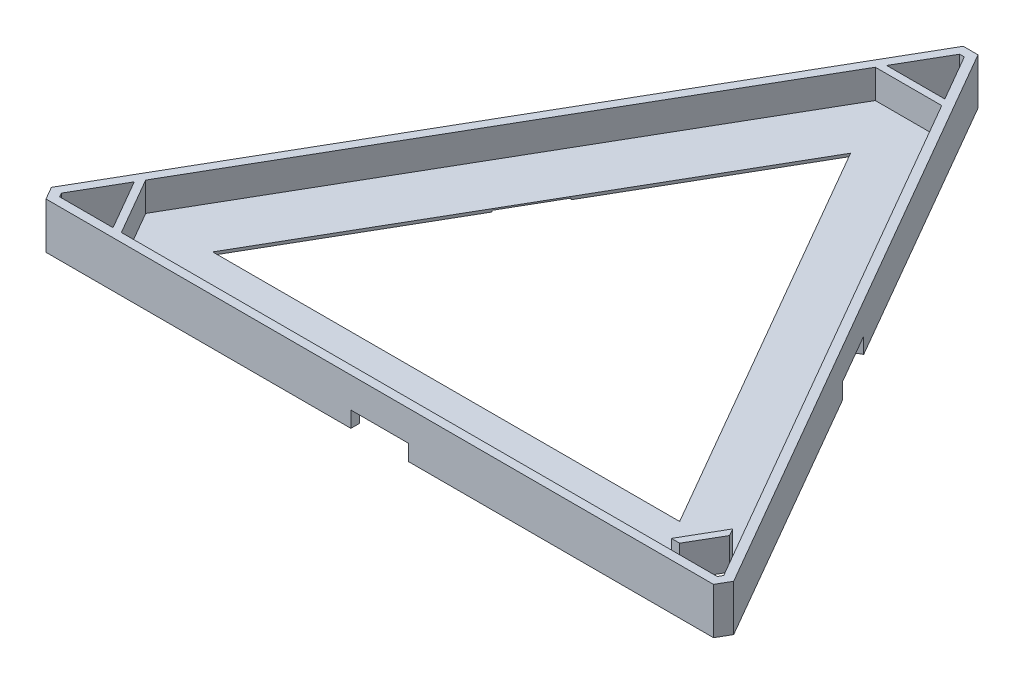
from build123d import *

# Parameters (mm, degrees)
BOSS_EXTRUDE1_DEPTH      = 1
BOSS_EXTRUDE2_DEPTH      = 11
BOSS_EXTRUDE3_DEPTH      = 10
BOSS_EXTRUDE3_DEPTH_BACK = 5
SKETCH3_W                = 20
SKETCH3_H                = 11
CUT_EXTRUDE3_DEPTH       = 25
SKETCH5_W                = 20
SKETCH5_H                = 11
CUT_EXTRUDE4_DEPTH       = 25
SKETCH6_W                = 20
SKETCH6_H                = 11
CUT_EXTRUDE5_DEPTH       = 25


with BuildPart() as part:
    # Sketch1 → Boss-Extrude1 (new body)
    with BuildSketch(Plane(origin=(0, 0, 0), x_dir=(1, 0, 0), z_dir=(0, 1, 0))):
        Polygon((243.304219773, -116.484791866), (254.809280576, -136.408896139), (442.602090749, -136.409305398), (444.621046679, -132.925433223), (441.749040748, -132.925433223), (449.516726723, -119.471406457), (450.964695297, -121.978953122), (452.699916621, -118.984688017), (358.778179035, 43.666038066), (335.767496284, 43.666038066), align=None)
        Polygon((428.113670919, -116.417164681), (266.439108268, -116.428009241), (347.273609729, 23.609230825), align=None, mode=Mode.SUBTRACT)
    extrude(amount=BOSS_EXTRUDE1_DEPTH)

    # Sketch1<9> → Boss-Extrude2 (add)
    # profile 1 of 2: a face of its own
    with BuildSketch(Plane(origin=(0, 0, 0), x_dir=(1, 0, 0), z_dir=(0, 1, 0))):
        Polygon((229.159432547, -134.984249184), (231.716666588, -139.412373829), (462.829865412, -139.412373829), (465.38624875, -134.984588004), (349.829542096, 65.165499075), (344.716133219, 65.165499075), align=None)
        Polygon((251.922647988, -136.4093054), (233.446303399, -136.408896139), (232.623553959, -134.984217358), (241.860901688, -118.984688019), align=None, mode=Mode.SUBTRACT)
        Polygon((442.602090749, -136.409305398), (254.809280576, -136.408896139), (243.304219773, -116.484791866), (335.767496284, 43.666038066), (358.778179035, 43.666038066), (461.938967957, -134.984588004), (461.116393748, -136.409305398), align=None, mode=Mode.SUBTRACT)
        Polygon((348.096628302, 62.164013367), (357.334800991, 46.166038067), (337.210874326, 46.166038067), (346.44844193, 62.165948237), align=None, mode=Mode.SUBTRACT)
    # profile 2 of 2: a face of its own
    with BuildSketch(Plane(origin=(0, 0, 0), x_dir=(1, 0, 0), z_dir=(0, 1, 0))):
        Polygon((441.749040748, -132.925433223), (444.621046679, -132.925433223), (450.964695297, -121.978953122), (449.516726723, -119.471406457), align=None)
    extrude(amount=BOSS_EXTRUDE2_DEPTH)

    # Sketch1<10> → Boss-Extrude3 (add, two sides: drawn at the far end of the back side and taken through both)
    with BuildSketch(Plane(origin=(0, 0, 0), x_dir=(1, 0, 0), z_dir=(0, 1, 0)).offset(-BOSS_EXTRUDE3_DEPTH_BACK)):
        Polygon((229.159432547, -134.984249184), (231.716666588, -139.412373829), (462.829865412, -139.412373829), (465.38624875, -134.984588004), (349.829542096, 65.165499075), (344.716133219, 65.165499075), align=None)
        Polygon((251.922647988, -136.4093054), (233.446303399, -136.408896139), (232.623553959, -134.984217358), (241.860901688, -118.984688019), align=None, mode=Mode.SUBTRACT)
        Polygon((442.602090749, -136.409305398), (254.809280576, -136.408896139), (243.304219773, -116.484791866), (335.767496284, 43.666038066), (358.778179035, 43.666038066), (452.699916621, -118.984688017), (461.938967957, -134.984588004), (461.116393748, -136.409305398), align=None, mode=Mode.SUBTRACT)
        Polygon((348.096628302, 62.164013367), (357.334800991, 46.166038067), (337.210874326, 46.166038067), (346.44844193, 62.165948237), align=None, mode=Mode.SUBTRACT)
    extrude(amount=BOSS_EXTRUDE3_DEPTH + BOSS_EXTRUDE3_DEPTH_BACK)

    # Sketch3 → Cut-Extrude3 (cut)
    with BuildSketch(Plane(origin=(290.589645397, 0, -167.772009994), x_dir=(-0.49999999999998745, 0, -0.8660254037844459), z_dir=(0.8660254037844459, 0, -0.49999999999998745))):
        with Locations((-236.592990632, -5)):
            Rectangle(SKETCH3_W, SKETCH3_H)
    extrude(amount=-CUT_EXTRUDE3_DEPTH, mode=Mode.SUBTRACT)

    # Sketch5 → Cut-Extrude4 (cut)
    with BuildSketch(Plane.XY.offset(139.412373829)):
        with Locations((347.273266, -5)):
            Rectangle(SKETCH5_W, SKETCH5_H)
    extrude(amount=-CUT_EXTRUDE4_DEPTH, mode=Mode.SUBTRACT)

    # Sketch6 → Cut-Extrude5 (cut)
    with BuildSketch(Plane(origin=(230.319375797, 0, 132.975171838), x_dir=(-0.5000006154012504, 0, 0.8660250484820695), z_dir=(-0.8660250484820695, 0, -0.5000006154012504))):
        with Locations((-113.2366748, -5)):
            Rectangle(SKETCH6_W, SKETCH6_H)
    extrude(amount=-CUT_EXTRUDE5_DEPTH, mode=Mode.SUBTRACT)


solid = part.part
